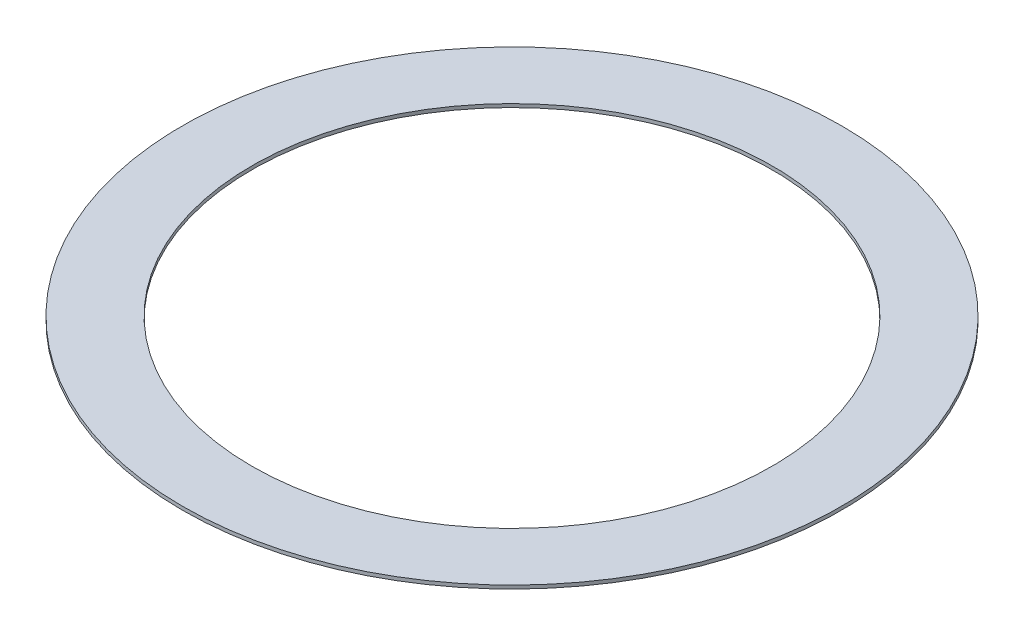
from build123d import *

# Parameters (mm, degrees)
SKETCH1_R           = 95
SKETCH1_R_2         = 75
BOSS_EXTRUDE1_DEPTH = 1


with BuildPart() as part:
    # Sketch1 → Boss-Extrude1 (new body)
    with BuildSketch(Plane(origin=(0, 0, 0), x_dir=(1, 0, 0), z_dir=(0, 1, 0))):
        with Locations(Location((0, 0, 0), (0, 0, 270))):
            Circle(SKETCH1_R)
        with Locations(Location((0, 0, 0), (0, 0, 270))):
            Circle(SKETCH1_R_2, mode=Mode.SUBTRACT)
    extrude(amount=BOSS_EXTRUDE1_DEPTH)


solid = part.part
